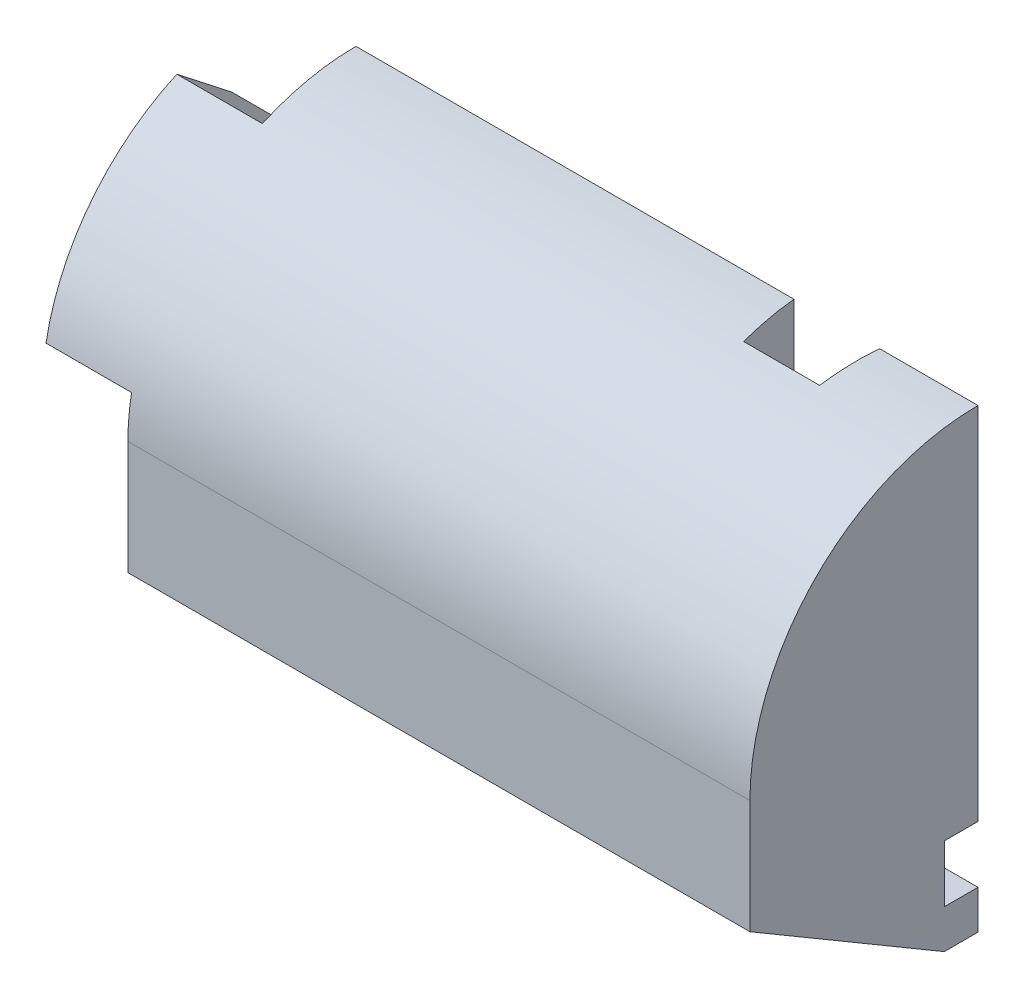
from build123d import *

# Parameters (mm, degrees)
BOSS_EXTRU_1_DEPTH      = 240
ESQUISSE2_R             = 28.575
ENL_V_MAT_EXTRU_1_DEPTH = 235
ESQUISSE3_R             = 44.45
ENL_V_MAT_EXTRU_2_DEPTH = 78
ENL_V_MAT_EXTRU_4_DEPTH = 13
BOSS_EXTRU_2_START      = -33
BOSS_EXTRU_2_DEPTH      = 33
ENL_V_MAT_EXTRU_5_DEPTH = 100


with BuildPart() as part:
    # Esquisse1 → Boss.-Extru.1 (new body)
    with BuildSketch(Plane(origin=(0, 0, 0), x_dir=(0, 0, -1), z_dir=(1, 0, 0))):
        with BuildLine():
            Line((0, 0), (0, 88))
            ThreePointArc((0, 88), (-62.225396744, 62.225396744), (-88, 0))
            Line((-88, 0), (-88, -43.853430349))
            Line((-88, -43.853430349), (-13, -88))
            Line((-13, -88), (0, -88))
            Line((0, -88), (0, 0))
        make_face()
    extrude(amount=BOSS_EXTRU_1_DEPTH)

    # Esquisse2 → Enlèv. mat.-Extru.1 (cut)
    with BuildSketch(Plane(origin=(0, 0, 0), x_dir=(0, 0, -1), z_dir=(1, 0, 0))):
        Circle(ESQUISSE2_R)
    extrude(amount=ENL_V_MAT_EXTRU_1_DEPTH, mode=Mode.SUBTRACT)

    # Esquisse3 → Enlèv. mat.-Extru.2 (cut)
    with BuildSketch(Plane(origin=(0, 0, 0), x_dir=(0, 0, -1), z_dir=(1, 0, 0))):
        Circle(ESQUISSE3_R)
    extrude(amount=ENL_V_MAT_EXTRU_2_DEPTH, mode=Mode.SUBTRACT)

    # Esquisse5 → Enlèv. mat.-Extru.4 (cut)
    with BuildSketch(Plane.XY):
        with BuildLine():
            ThreePointArc((127, -73), (116, -62), (127, -51))
            Line((127, -51), (240, -51))
            Line((240, -51), (240, -73))
            Line((240, -73), (127, -73))
        make_face()
    extrude(amount=ENL_V_MAT_EXTRU_4_DEPTH, mode=Mode.SUBTRACT)

    # Esquisse6 → Boss.-Extru.2 (add)
    with BuildSketch(Plane(origin=(0, 0, 0), x_dir=(0, 0, -1), z_dir=(1, 0, 0)).offset(BOSS_EXTRU_2_START)):
        with BuildLine():
            Line((-65.430668922, -0.909705656), (-40.188548434, 31.398735242))
            Line((-40.188548434, 31.398735242), (-14.946427946, 63.707176139))
            Line((-14.946427946, 63.707176139), (-36.116548227, 80.247086827))
            ThreePointArc((-36.116548227, 80.247086827), (-69.344946317, 54.178209829), (-86.600789204, 15.630205031))
            Line((-86.600789204, 15.630205031), (-65.430668922, -0.909705656))
        make_face()
    extrude(amount=BOSS_EXTRU_2_DEPTH)

    # Esquisse7 → Enlèv. mat.-Extru.5 (cut)
    with BuildSketch(Plane(origin=(0, 0, 0), x_dir=(1, 0, 0), z_dir=(0, 1, 0))):
        Polygon((202, 0), (169, 0), (170.857438953, -21.230624387), (200.142561047, -21.230624387), align=None)
    extrude(amount=ENL_V_MAT_EXTRU_5_DEPTH, mode=Mode.SUBTRACT)


solid = part.part
